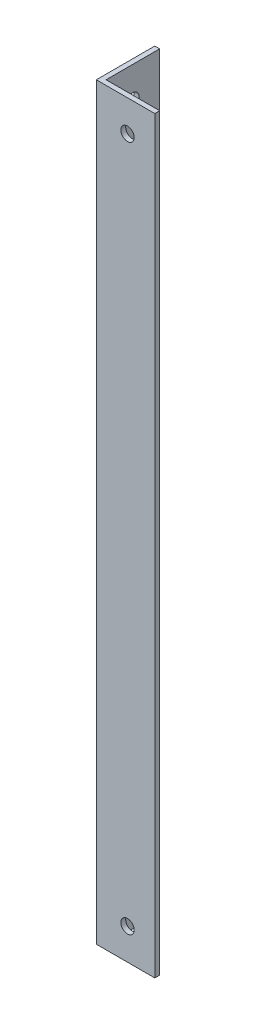
from build123d import *

# Parameters (mm, degrees)
BOSS_EXTRUDE1_DEPTH = 243.84
SKETCH2_R           = 2.1828125
CUT_EXTRUDE1_DEPTH  = 2.54
SKETCH3_R           = 2.1828125
CUT_EXTRUDE2_DEPTH  = 246.205601499


with BuildPart() as part:
    # Sketch1 → Boss-Extrude1 (new body)
    with BuildSketch(Plane(origin=(0, 0, 0), x_dir=(1, 0, 0), z_dir=(0, 1, 0))):
        Polygon((0, 0), (0, 19.05), (1.5875, 19.05), (1.5875, 1.5875), (19.05, 1.5875), (19.05, 0), align=None)
    extrude(amount=BOSS_EXTRUDE1_DEPTH)

    # Sketch2 → Cut-Extrude1 (cut)
    with BuildSketch(Plane.XY):
        with Locations((10.16, 233.68)):
            Circle(SKETCH2_R)
        with Locations((10.16, 10.16)):
            Circle(SKETCH2_R)
    extrude(amount=-CUT_EXTRUDE1_DEPTH, mode=Mode.SUBTRACT)

    # Sketch3 → Cut-Extrude2 (cut, through all)
    with BuildSketch(Plane(origin=(1.5875, 0, 0), x_dir=(0, 0, -1), z_dir=(1, 0, 0))):
        with Locations((10.16, 233.68)):
            Circle(SKETCH3_R)
        with Locations((10.16, 10.16)):
            Circle(SKETCH3_R)
    extrude(amount=-CUT_EXTRUDE2_DEPTH, mode=Mode.SUBTRACT)


solid = part.part
